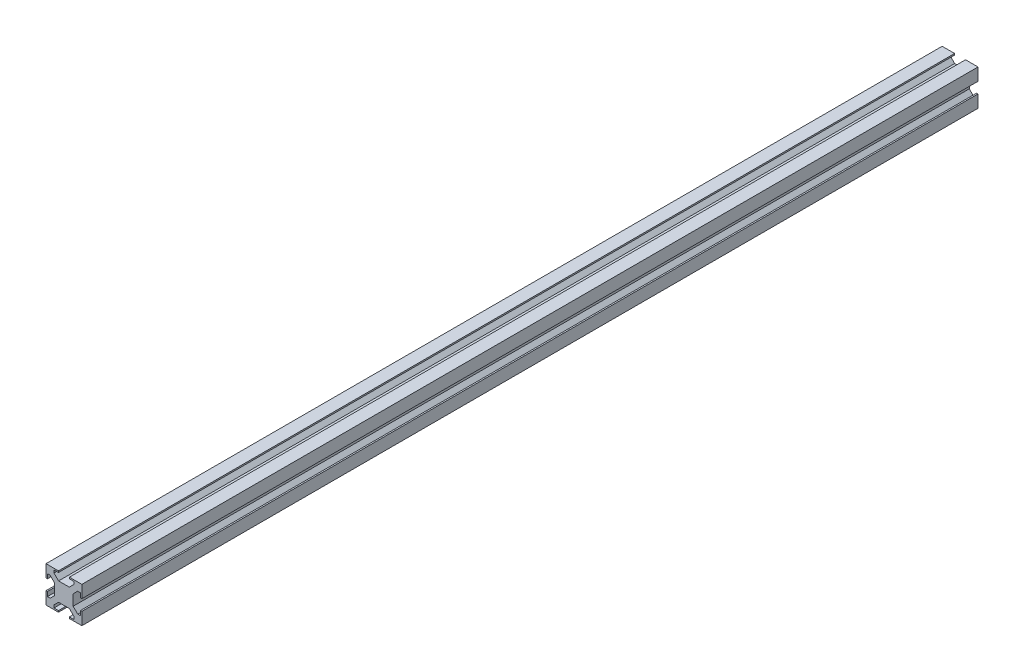
from build123d import *

# Parameters (mm, degrees)
EXTRUDE_1_DEPTH = 500


with BuildPart() as part:
    # 草图1 → 凸台-拉伸1 (new body)
    with BuildSketch(Plane.XY):
        Polygon((-10, -3.05), (-10, -10), (-3.05, -10), (-3.05, -9.2), (-5.55, -9.2), (-5.55, -7.7), (-3, -5.15), (3, -5.15), (5.55, -7.7), (5.55, -9.2), (3.05, -9.2), (3.05, -10), (10, -10), (10, -3.05), (9.2, -3.05), (9.2, -5.55), (7.7, -5.55), (5.15, -3), (5.15, 3), (7.7, 5.55), (9.2, 5.55), (9.2, 3.05), (10, 3.05), (10, 10), (3.05, 10), (3.05, 9.2), (5.55, 9.2), (5.55, 7.7), (3, 5.15), (-3, 5.15), (-5.55, 7.7), (-5.55, 9.2), (-3.05, 9.2), (-3.05, 10), (-10, 10), (-10, 3.05), (-9.2, 3.05), (-9.2, 5.55), (-7.7, 5.55), (-5.15, 3), (-5.15, -3), (-7.7, -5.55), (-9.2, -5.55), (-9.2, -3.05), align=None)
    extrude(amount=EXTRUDE_1_DEPTH)


solid = part.part
